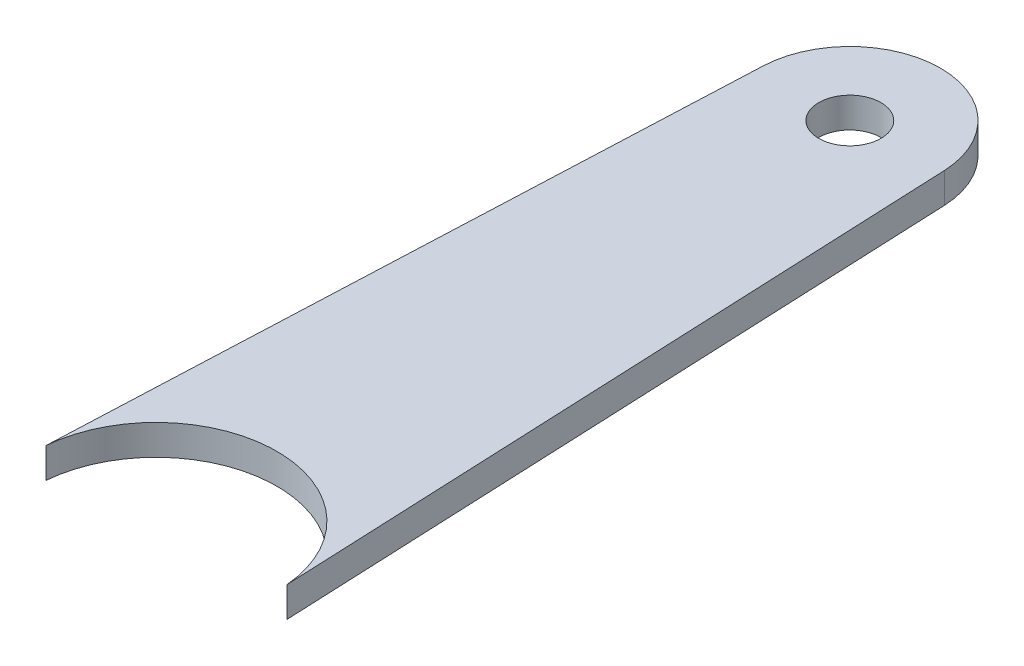
from build123d import *

# Parameters (mm, degrees)
SKETCH1_R           = 3.2639
BOSS_EXTRUDE2_DEPTH = 3.175


with BuildPart() as part:
    # Sketch1 → Boss-Extrude2 (new body)
    with BuildSketch(Plane(origin=(0, 0, 0), x_dir=(1, 0, 0), z_dir=(0, 1, 0))):
        with BuildLine():
            Line((3.183974864, 73.293609178), (0.047843391, 1.101332439))
            ThreePointArc((0.047843391, 1.101332439), (12.7, 12.7), (25.352156609, 1.101332439))
            Line((25.352156609, 1.101332439), (22.216025136, 73.293609178))
            ThreePointArc((22.216025136, 73.293609178), (12.7, 82.40522), (3.183974864, 73.293609178))
        make_face()
        with Locations(Location((12.7, 72.88022, 0), (0, 0, 270))):
            Circle(SKETCH1_R, mode=Mode.SUBTRACT)
    extrude(amount=BOSS_EXTRUDE2_DEPTH)


solid = part.part
